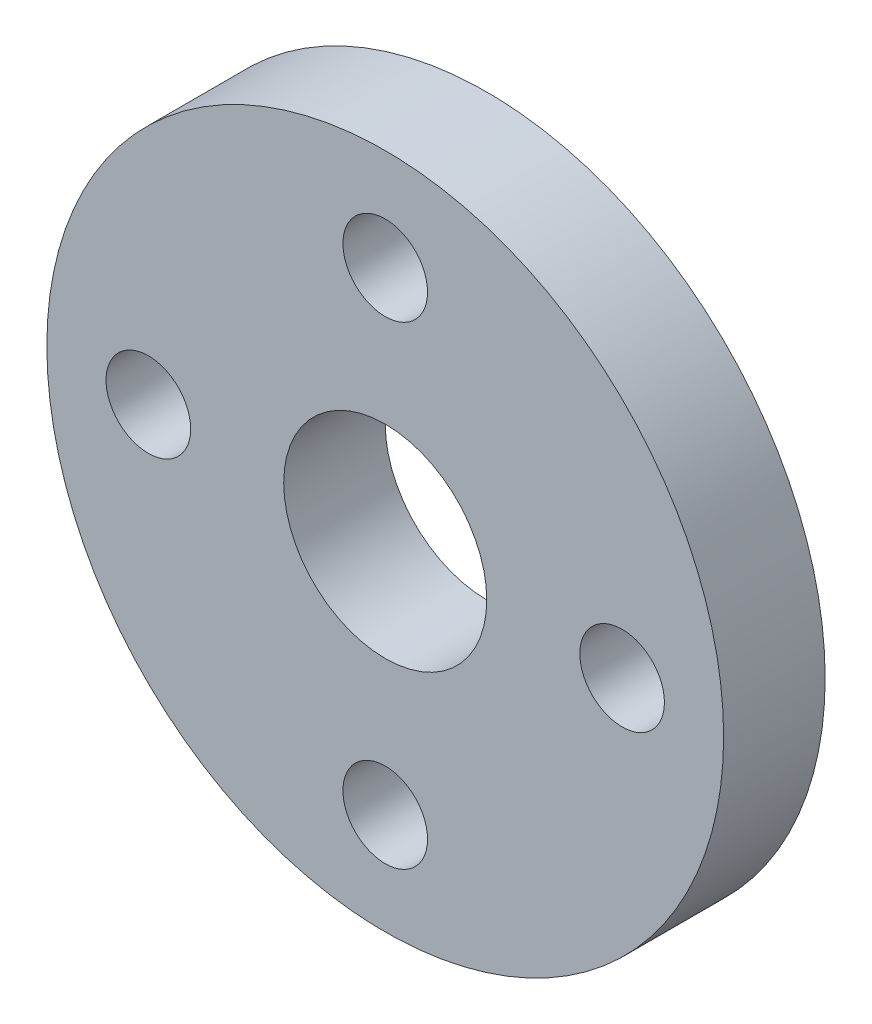
from build123d import *

# Parameters (mm, degrees)
SKETCH_1_R         = 10
SKETCH_1_R_2       = 3
EXTRUDE_1_DEPTH    = 3
HOLE_WIZARD_M3_1_D = 2.5


with BuildPart() as part:
    # 草图1 → 凸台-拉伸1 (new body)
    with BuildSketch(Plane.XY):
        Circle(SKETCH_1_R)
        Circle(SKETCH_1_R_2, mode=Mode.SUBTRACT)
    extrude(amount=EXTRUDE_1_DEPTH)

    # M3 螺纹孔1 (through all)
    with Locations(Plane(origin=(0, 7, 3), x_dir=(1, 0, 0), z_dir=(0, 0, 1))):
        with Locations((0, 0), (-7, -7), (0, -14), (7, -7)):
            Hole(HOLE_WIZARD_M3_1_D / 2)


solid = part.part
